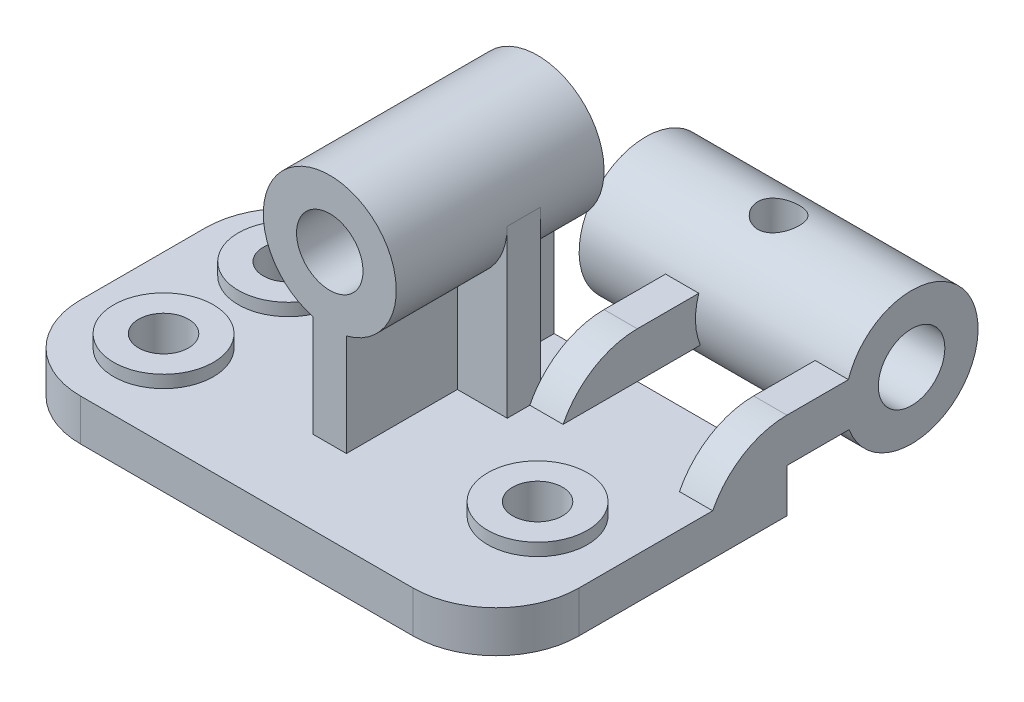
from build123d import *

# Parameters (mm, degrees)
SKETCH_3_R               = 12
EXTRUDE_2_DEPTH          = 20
SKETCH_3_7_R             = 24
SKETCH_3_7_R_2           = 12
EXTRUDE_3_DEPTH          = 26
EXTRUDE_5_DEPTH          = 100
EXTRUDE_6_REACH          = 180.449
EXTRUDE_6_END_RADIUS     = 32
SKETCH_15_W              = 16
SKETCH_15_H              = 100
EXTRUDE_9_REACH          = 180.449
EXTRUDE_9_END_RADIUS     = 32
SKETCH_16_W              = 24
SKETCH_16_H              = 16
SKETCH_25_R              = 32
SKETCH_25_R_2            = 16
EXTRUDE_10_DEPTH         = 128
CUT_EXTRUDE_1_DEPTH      = 231.628319156
CUT_EXTRUDE_1_DEPTH_BACK = 231.628319156
SKETCH_28_R              = 10
EXTRUDE_11_DEPTH         = 16
EXTRUDE_12_DEPTH         = 16
EXTRUDE_13_REACH         = 228.769
EXTRUDE_13_END_RADIUS    = 32
EXTRUDE_14_REACH         = 228.769
EXTRUDE_14_END_RADIUS    = 32
SKETCH_38_W              = 16
SKETCH_38_H              = 22


with BuildPart() as part:
    # 草图3 → 凸台-拉伸2 (new body)
    with BuildSketch(Plane(origin=(0, 0, 0), x_dir=(1, 0, 0), z_dir=(0, 1, 0))):
        with BuildLine():
            ThreePointArc((-120, -30), (-108.284271247, -58.284271247), (-80, -70))
            Line((-80, -70), (80, -70))
            ThreePointArc((80, -70), (108.284271247, -58.284271247), (120, -30))
            Line((120, -30), (120, 70))
            Line((120, 70), (-80, 70))
            ThreePointArc((-80, 70), (-108.284271247, 58.284271247), (-120, 30))
            Line((-120, 30), (-120, -30))
        make_face()
        with Locations((-80, 30)):
            Circle(SKETCH_3_R, mode=Mode.SUBTRACT)
        with Locations((-80, -30)):
            Circle(SKETCH_3_R, mode=Mode.SUBTRACT)
        with Locations((80, -10)):
            Circle(SKETCH_3_R, mode=Mode.SUBTRACT)
    extrude(amount=EXTRUDE_2_DEPTH)

    # 草图3<7> → 凸台-拉伸3 (add)
    # profile 1 of 3: a face of its own
    with BuildSketch(Plane(origin=(0, 0, 0), x_dir=(1, 0, 0), z_dir=(0, 1, 0))):
        with Locations((-80, 30)):
            Circle(SKETCH_3_7_R)
        with Locations((-80, 30)):
            Circle(SKETCH_3_7_R_2, mode=Mode.SUBTRACT)
    # profile 2 of 3: a face of its own
    with BuildSketch(Plane(origin=(0, 0, 0), x_dir=(1, 0, 0), z_dir=(0, 1, 0))):
        with Locations((-80, -30)):
            Circle(SKETCH_3_7_R)
        with Locations((-80, -30)):
            Circle(SKETCH_3_7_R_2, mode=Mode.SUBTRACT)
    # profile 3 of 3: a face of its own
    with BuildSketch(Plane(origin=(0, 0, 0), x_dir=(1, 0, 0), z_dir=(0, 1, 0))):
        with Locations((80, -10)):
            Circle(SKETCH_3_7_R)
        with Locations((80, -10)):
            Circle(SKETCH_3_7_R_2, mode=Mode.SUBTRACT)
    extrude(amount=EXTRUDE_3_DEPTH)



with BuildPart() as body_2:
    # 草图10 → 凸台-拉伸5 (new body)
    with BuildSketch(Plane(origin=(0, 0, -70), x_dir=(-1, 0, 0), z_dir=(0, 0, -1))):
        with BuildLine():
            ThreePointArc((32, 100), (-22.627416998, 122.627416998), (0, 68))
            ThreePointArc((0, 68), (22.627416998, 77.372583002), (32, 100))
        make_face()
        with BuildLine():
            ThreePointArc((16, 100), (11.313708499, 88.686291501), (0, 84))
            ThreePointArc((0, 84), (-11.313708499, 111.313708499), (16, 100))
        make_face(mode=Mode.SUBTRACT)
    extrude(amount=-EXTRUDE_5_DEPTH)


with BuildPart() as part_1:
    add(part.part)

    add(body_2.part)  # 凸台-拉伸6 merges body 2
    # 凸台-拉伸6: up to this cylinder (the profile starts outside it)
    extrude_6_end = Plane(origin=(0, 100, -20), z_dir=(0, 0, -1)) * Cylinder(EXTRUDE_6_END_RADIUS, 425.898, mode=Mode.PRIVATE)
    # 草图15 → 凸台-拉伸6 (add, up to the surface)
    with BuildSketch(Plane(origin=(0, 20, 0), x_dir=(1, 0, 0), z_dir=(0, 1, 0)), mode=Mode.PRIVATE) as extrude_6_sk1:
        with Locations((0, 20)):
            Rectangle(SKETCH_15_W, SKETCH_15_H)
    extrude_6_tool1 = extrude(extrude_6_sk1.sketch, amount=EXTRUDE_6_REACH, mode=Mode.PRIVATE) - extrude_6_end
    add(extrude_6_tool1.solids().sort_by_distance((0, 20, -20))[0])

    # 凸台-拉伸9: up to this cylinder (the profile starts outside it)
    extrude_9_end = Plane(origin=(0, 100, -31.409304), z_dir=(0, 0, -1)) * Cylinder(EXTRUDE_9_END_RADIUS, 425.898, mode=Mode.PRIVATE)
    # 草图16 → 凸台-拉伸9 (add, up to the surface)
    with BuildSketch(Plane(origin=(0, 20, 0), x_dir=(1, 0, 0), z_dir=(0, 1, 0)), mode=Mode.PRIVATE) as extrude_9_sk1:
        with Locations((20, 31.409304245)):
            Rectangle(SKETCH_16_W, SKETCH_16_H)
    extrude_9_tool1 = extrude(extrude_9_sk1.sketch, amount=EXTRUDE_9_REACH, mode=Mode.PRIVATE) - extrude_9_end
    add(extrude_9_tool1.solids().sort_by_distance((20, 20, -31.409304))[0])
    # 草图16 → 凸台-拉伸9 (add, up to the surface)
    with BuildSketch(Plane(origin=(0, 20, 0), x_dir=(1, 0, 0), z_dir=(0, 1, 0)), mode=Mode.PRIVATE) as extrude_9_sk2:
        with Locations((-20, 31.409304245)):
            Rectangle(SKETCH_16_W, SKETCH_16_H)
    extrude_9_tool2 = extrude(extrude_9_sk2.sketch, amount=EXTRUDE_9_REACH, mode=Mode.PRIVATE) - extrude_9_end
    add(extrude_9_tool2.solids().sort_by_distance((-20, 20, -31.409304))[0])

    # 草图30 → 凸台-拉伸11 (add)
    with BuildSketch(Plane(origin=(120, 0, 0), x_dir=(0, 0, -1), z_dir=(1, 0, 0))):
        with BuildLine():
            Line((70, 42), (70, 20))
            Line((70, 20), (34.278857801, 20))
            ThreePointArc((34.278857801, 20), (49.023823037, 36.058772732), (70, 42))
        make_face()
    extrude(amount=-EXTRUDE_11_DEPTH)

    # 草图34 → 凸台-拉伸12 (add)
    with BuildSketch(Plane(origin=(48, 0, 0), x_dir=(0, 0, -1), z_dir=(1, 0, 0))):
        with BuildLine():
            ThreePointArc((70, 42), (49.023823037, 36.058772732), (34.278857801, 20))
            Line((34.278857801, 20), (70, 20))
            Line((70, 20), (70, 42))
        make_face()
    extrude(amount=-EXTRUDE_12_DEPTH)



with BuildPart() as body_2_2:
    # 草图25 → 凸台-拉伸10 (new body)
    with BuildSketch(Plane(origin=(120, 0, 0), x_dir=(0, 0, -1), z_dir=(1, 0, 0))):
        with Locations((130.004387585, 32)):
            Circle(SKETCH_25_R)
        with Locations((130.004387585, 32)):
            Circle(SKETCH_25_R_2, mode=Mode.SUBTRACT)
    extrude(amount=-EXTRUDE_10_DEPTH)

    # 草图28 → 切除-拉伸1 (cut, two sides: drawn at the far end of the back side and taken through both)
    with BuildSketch(Plane(origin=(0, 20, 0), x_dir=(1, 0, 0), z_dir=(0, 1, 0)).offset(-CUT_EXTRUDE_1_DEPTH_BACK)):
        with Locations((56, 130.004387585)):
            Circle(SKETCH_28_R)
    extrude(amount=CUT_EXTRUDE_1_DEPTH + CUT_EXTRUDE_1_DEPTH_BACK, mode=Mode.SUBTRACT)


with BuildPart() as part_2:
    add(part_1.part)

    add(body_2_2.part)  # 凸台-拉伸13 merges body 2 2
    # 凸台-拉伸13: up to this cylinder (the profile starts outside it)
    extrude_13_end = Plane(origin=(111.937984, 32, -130.004387585), z_dir=(1, 0, 0)) * Cylinder(EXTRUDE_13_END_RADIUS, 522.538, mode=Mode.PRIVATE)
    # 草图37 → 凸台-拉伸13 (add, up to the surface)
    with BuildSketch(Plane(origin=(0, 0, -70), x_dir=(-1, 0, 0), z_dir=(0, 0, -1)), mode=Mode.PRIVATE) as extrude_13_sk1:
        Polygon((-104, 20), (-120, 21), (-120, 42), (-104, 42), align=None)
    extrude_13_tool1 = extrude(extrude_13_sk1.sketch, amount=EXTRUDE_13_REACH, mode=Mode.PRIVATE) - extrude_13_end
    add(extrude_13_tool1.solids().sort_by_distance((111.937984, 31.248062, -70))[0])

    # 凸台-拉伸14: up to this cylinder (the profile starts outside it)
    extrude_14_end = Plane(origin=(40, 32, -130.004387585), z_dir=(1, 0, 0)) * Cylinder(EXTRUDE_14_END_RADIUS, 522.538, mode=Mode.PRIVATE)
    # 草图38 → 凸台-拉伸14 (add, up to the surface)
    with BuildSketch(Plane(origin=(0, 0, -70), x_dir=(-1, 0, 0), z_dir=(0, 0, -1)), mode=Mode.PRIVATE) as extrude_14_sk1:
        with Locations((-40, 31)):
            Rectangle(SKETCH_38_W, SKETCH_38_H)
    extrude_14_tool1 = extrude(extrude_14_sk1.sketch, amount=EXTRUDE_14_REACH, mode=Mode.PRIVATE) - extrude_14_end
    add(extrude_14_tool1.solids().sort_by_distance((40, 31, -70))[0])


solid = part_2.part
